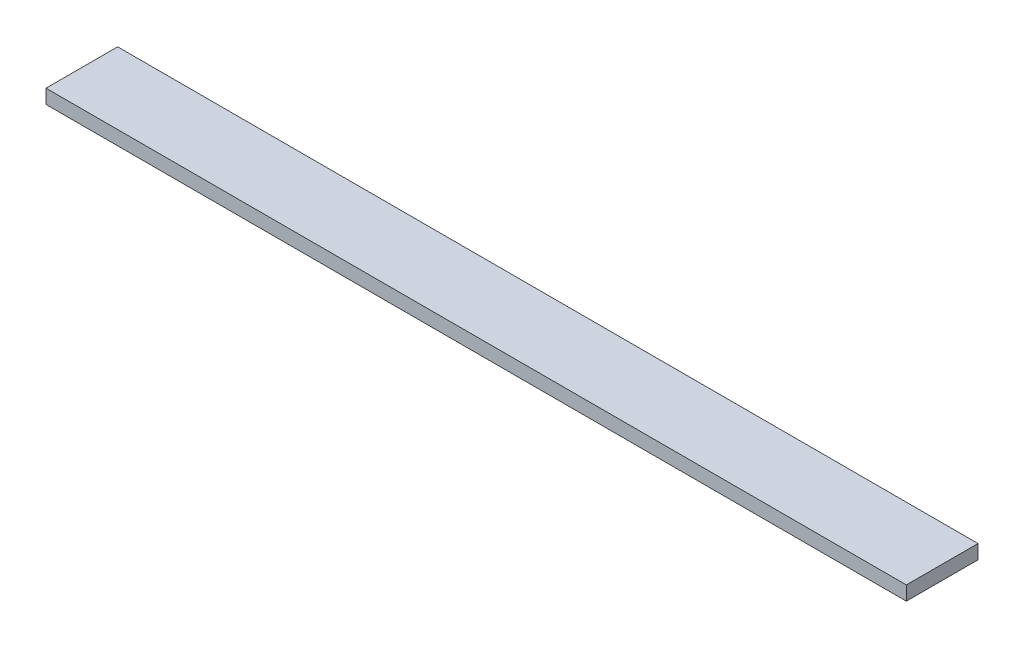
from build123d import *

# Parameters (mm, degrees)
SKETCH1_W           = 25.4
SKETCH1_H           = 5
BOSS_EXTRUDE1_DEPTH = 305
SKETCH2_W           = 200
SKETCH2_H           = 10
BOSS_EXTRUDE2_DEPTH = 0.5


with BuildPart() as part:
    # Sketch1 → Boss-Extrude1 (new body)
    with BuildSketch(Plane(origin=(0, 0, 0), x_dir=(0, 0, -1), z_dir=(1, 0, 0))):
        Rectangle(SKETCH1_W, SKETCH1_H)
    extrude(amount=BOSS_EXTRUDE1_DEPTH)


with BuildPart() as body_2:
    # Sketch2 → Boss-Extrude2 (new body)
    with BuildSketch(Plane.XZ.offset(2.5)):
        with Locations((152.5, 0)):
            Rectangle(SKETCH2_W, SKETCH2_H)
    extrude(amount=BOSS_EXTRUDE2_DEPTH)


solid = Compound([part.part, body_2.part])
